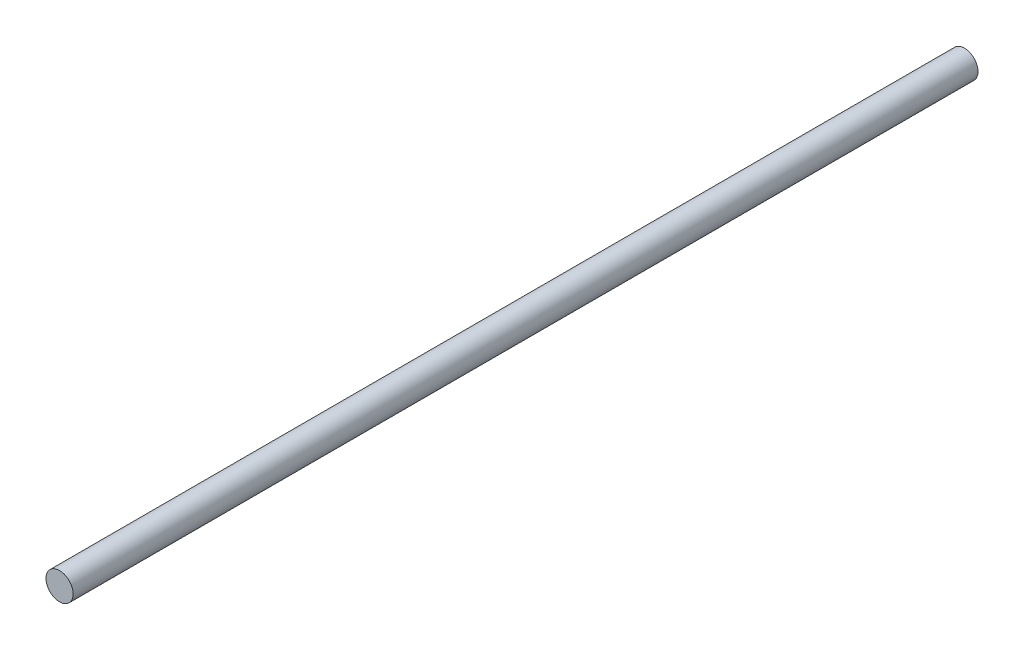
from build123d import *

# Parameters (mm, degrees)
ESQUISSE1_R        = 3
BOSS_EXTRU_1_DEPTH = 200


with BuildPart() as part:
    # Esquisse1 → Boss.-Extru.1 (new body)
    with BuildSketch(Plane.XY):
        Circle(ESQUISSE1_R)
    extrude(amount=BOSS_EXTRU_1_DEPTH)


solid = part.part
